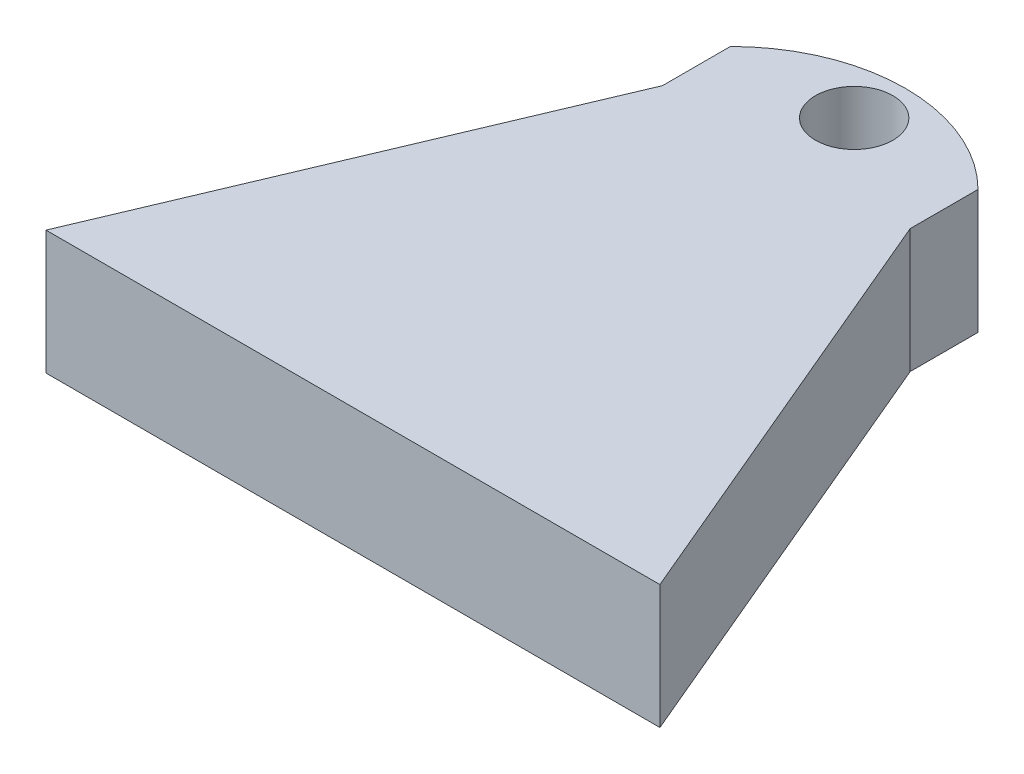
from build123d import *

# Parameters (mm, degrees)
SKETCH1_R           = 7.9375
BOSS_EXTRUDE1_DEPTH = 25.4


with BuildPart() as part:
    # Sketch1 → Boss-Extrude1 (new body)
    with BuildSketch(Plane(origin=(0, 0, 0), x_dir=(1, 0, 0), z_dir=(0, 1, 0))):
        with BuildLine():
            Line((0, 0), (125.933617728, 0))
            Line((125.933617728, 0), (88.366808864, 88.9))
            Line((88.366808864, 88.9), (88.366808864, 102.81634275))
            ThreePointArc((88.366808864, 102.81634275), (62.966808864, 113.337367234), (37.566808864, 102.81634275))
            Line((37.566808864, 102.81634275), (37.566808864, 88.9))
            Line((37.566808864, 88.9), (0, 0))
        make_face()
        with Locations(Location((62.966808864, 102.81634275, 0), (0, 0, 270))):
            Circle(SKETCH1_R, mode=Mode.SUBTRACT)
    extrude(amount=BOSS_EXTRUDE1_DEPTH)


solid = part.part
